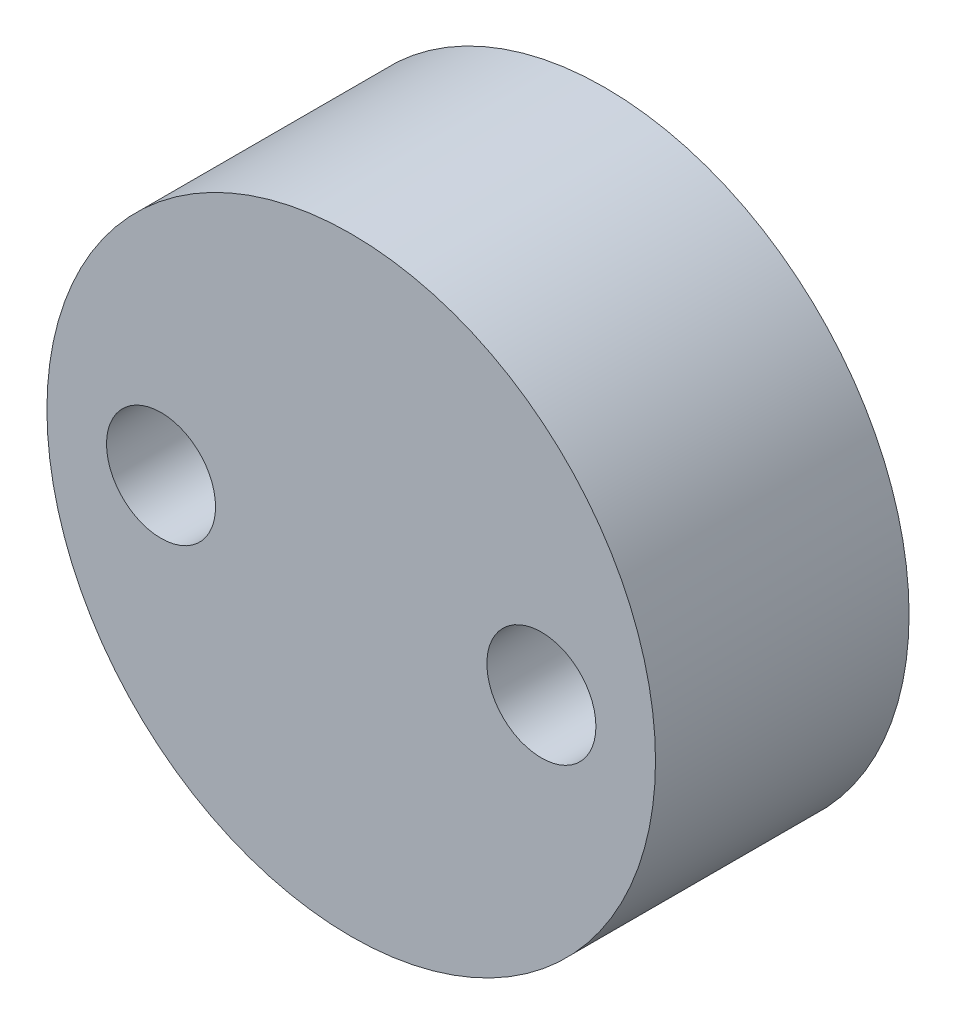
from build123d import *

# Parameters (mm, degrees)
SKETCH_1_R          = 12
EXTRUDE_1_DEPTH     = 10
SKETCH_2_R          = 2.15
CUT_EXTRUDE_1_DEPTH = 10


with BuildPart() as part:
    # ｽｹｯﾁ1 → ﾎﾞｽ - 押し出し1 (new body)
    with BuildSketch(Plane.XY):
        Circle(SKETCH_1_R)
    extrude(amount=EXTRUDE_1_DEPTH)

    # ｽｹｯﾁ2 → ｶｯﾄ - 押し出し1 (cut)
    with BuildSketch(Plane.XY.offset(10)):
        with Locations((7.5, 0)):
            Circle(SKETCH_2_R)
        with Locations((-7.5, 0)):
            Circle(SKETCH_2_R)
    extrude(amount=-CUT_EXTRUDE_1_DEPTH, mode=Mode.SUBTRACT)


solid = part.part
